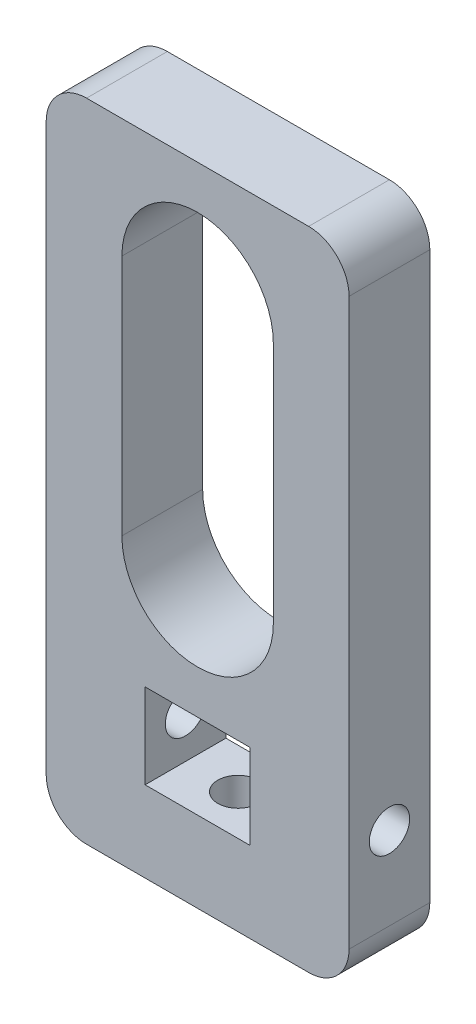
from build123d import *

# Parameters (mm, degrees)
SKETCH1_W           = 13.208
SKETCH1_H           = 10.668
BOSS_EXTRUDE2_DEPTH = 10.16
SKETCH4_R           = 2.54
CUT_EXTRUDE1_DEPTH  = 38.1
SKETCH6_R           = 2.54
CUT_EXTRUDE2_DEPTH  = 10.16


with BuildPart() as part:
    # Sketch1 → Boss-Extrude2 (new body)
    with BuildSketch(Plane.XY):
        with BuildLine():
            Line((0, 0), (0, 66.04))
            ThreePointArc((0, 66.04), (1.487897552, 69.632102448), (5.08, 71.12))
            Line((5.08, 71.12), (33.02, 71.12))
            ThreePointArc((33.02, 71.12), (36.612102448, 69.632102448), (38.1, 66.04))
            Line((38.1, 66.04), (38.1, 0))
            Line((38.1, 0), (38.1, -5.08))
            ThreePointArc((38.1, -5.08), (36.612102448, -8.672102448), (33.02, -10.16))
            Line((33.02, -10.16), (5.08, -10.16))
            ThreePointArc((5.08, -10.16), (1.487897552, -8.672102448), (0, -5.08))
            Line((0, -5.08), (0, 0))
        make_face()
        with Locations((19.05, 5.334)):
            Rectangle(SKETCH1_W, SKETCH1_H, mode=Mode.SUBTRACT)
        with BuildLine():
            Line((9.525, 56.134), (9.525, 25.654))
            ThreePointArc((9.525, 25.654), (19.05, 16.129), (28.575, 25.654))
            Line((28.575, 25.654), (28.575, 56.134))
            ThreePointArc((28.575, 56.134), (19.05, 65.659), (9.525, 56.134))
        make_face(mode=Mode.SUBTRACT)
    extrude(amount=BOSS_EXTRUDE2_DEPTH)

    # Sketch4 → Cut-Extrude1 (cut)
    with BuildSketch(Plane.ZY):
        with Locations((5.08, 5.334)):
            Circle(SKETCH4_R)
    extrude(amount=-CUT_EXTRUDE1_DEPTH, mode=Mode.SUBTRACT)

    # Sketch6 → Cut-Extrude2 (cut)
    with BuildSketch(Plane.XZ.offset(10.16)):
        with Locations(Location((19.05, 5.08, 0), (0, 0, 270))):
            Circle(SKETCH6_R)
    extrude(amount=-CUT_EXTRUDE2_DEPTH, mode=Mode.SUBTRACT)


solid = part.part
